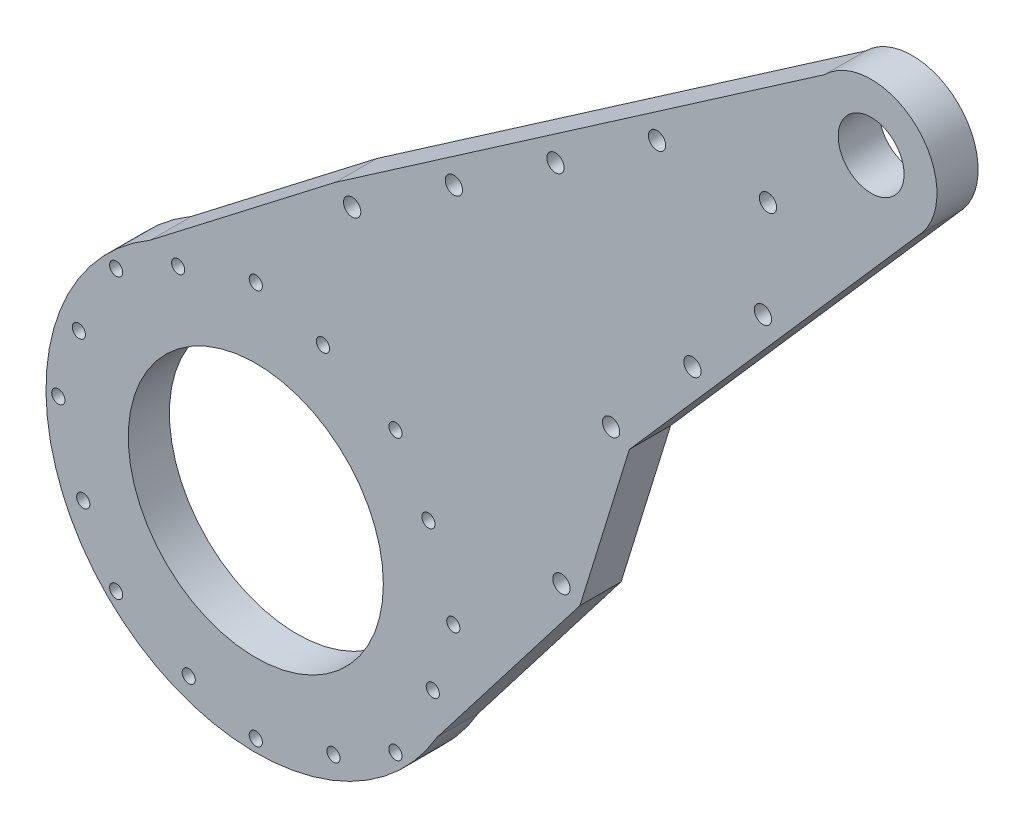
from build123d import *

# Parameters (mm, degrees)
SKETCH_2_R      = 2.1
SKETCH_2_R_2    = 1.6
SKETCH_2_R_3    = 8
SKETCH_2_R_4    = 31
EXTRUDE_1_DEPTH = 10


with BuildPart() as part:
    # 草图2 → 凸台-拉伸1 (new body)
    with BuildSketch(Plane.XY):
        with BuildLine():
            Line((81.141158551, 103.50108814), (-37.710043915, 21.419438295))
            Line((-37.710043915, 21.419438295), (-82.77215927, -13.299292234))
            ThreePointArc((-82.77215927, -13.299292234), (-93.160663011, -93.428150421), (-13.031804825, -83.03964668))
            Line((-13.031804825, -83.03964668), (21.686925704, -37.977531325))
            Line((21.686925704, -37.977531325), (33.707740984, 0.91334164))
            Line((33.707740984, 0.91334164), (103.768575549, 80.873671142))
            ThreePointArc((103.768575549, 80.873671142), (103.768575549, 103.50108814), (81.141158551, 103.50108814))
        make_face()
        with Locations((17.176075274, -35.63988511)):
            Circle(SKETCH_2_R, mode=Mode.SUBTRACT)
        with Locations((67.37860693, 69.690245447)):
            Circle(SKETCH_2_R, mode=Mode.SUBTRACT)
        with Locations((40.414990788, 69.298046443)):
            Circle(SKETCH_2_R, mode=Mode.SUBTRACT)
        with Locations((15.729805139, 52.249832182)):
            Circle(SKETCH_2_R, mode=Mode.SUBTRACT)
        with Locations((-8.95538051, 35.201617921)):
            Circle(SKETCH_2_R, mode=Mode.SUBTRACT)
        with Locations((29.24523113, 3.407383835)):
            Circle(SKETCH_2_R, mode=Mode.SUBTRACT)
        with Locations((49.015635424, 25.971317758)):
            Circle(SKETCH_2_R, mode=Mode.SUBTRACT)
        with Locations((66.149985812, 45.526727158)):
            Circle(SKETCH_2_R, mode=Mode.SUBTRACT)
        with Locations((-33.680842426, 18.211870041)):
            Circle(SKETCH_2_R, mode=Mode.SUBTRACT)
        with Locations((-105.098217171, -57.36570458)):
            Circle(SKETCH_2_R_2, mode=Mode.SUBTRACT)
        with Locations((-91.039342668, -23.424579083)):
            Circle(SKETCH_2_R_2, mode=Mode.SUBTRACT)
        with Locations((-57.098217171, -9.36570458)):
            Circle(SKETCH_2_R_2, mode=Mode.SUBTRACT)
        with Locations((-23.157091674, -23.424579083)):
            Circle(SKETCH_2_R_2, mode=Mode.SUBTRACT)
        with Locations((-9.098217171, -57.36570458)):
            Circle(SKETCH_2_R_2, mode=Mode.SUBTRACT)
        with Locations((-23.157091674, -91.306830077)):
            Circle(SKETCH_2_R_2, mode=Mode.SUBTRACT)
        with Locations((-57.098217171, -105.36570458)):
            Circle(SKETCH_2_R_2, mode=Mode.SUBTRACT)
        with Locations((-91.039342668, -91.306830077)):
            Circle(SKETCH_2_R_2, mode=Mode.SUBTRACT)
        with Locations((92.45486705, 92.187379641)):
            Circle(SKETCH_2_R_3, mode=Mode.SUBTRACT)
        with Locations((-100.110871654, -41.058909852)):
            Circle(SKETCH_2_R_2, mode=Mode.SUBTRACT)
        with Locations((-73.405011899, -100.378359063)):
            Circle(SKETCH_2_R_2, mode=Mode.SUBTRACT)
        with Locations((-14.085562688, -73.672499309)):
            Circle(SKETCH_2_R_2, mode=Mode.SUBTRACT)
        with Locations((-57.098217171, -57.36570458)):
            Circle(SKETCH_2_R_4, mode=Mode.SUBTRACT)
        with Locations((-15.153032377, -38.48181005)):
            Circle(SKETCH_2_R_2, mode=Mode.SUBTRACT)
        with Locations((-38.214322641, -99.310889374)):
            Circle(SKETCH_2_R_2, mode=Mode.SUBTRACT)
        with Locations((-99.043401964, -76.24959911)):
            Circle(SKETCH_2_R_2, mode=Mode.SUBTRACT)
        with Locations((-75.982111701, -15.420519787)):
            Circle(SKETCH_2_R_2, mode=Mode.SUBTRACT)
        with Locations((-40.791422442, -14.353050097)):
            Circle(SKETCH_2_R_2, mode=Mode.SUBTRACT)
    extrude(amount=EXTRUDE_1_DEPTH)


solid = part.part
